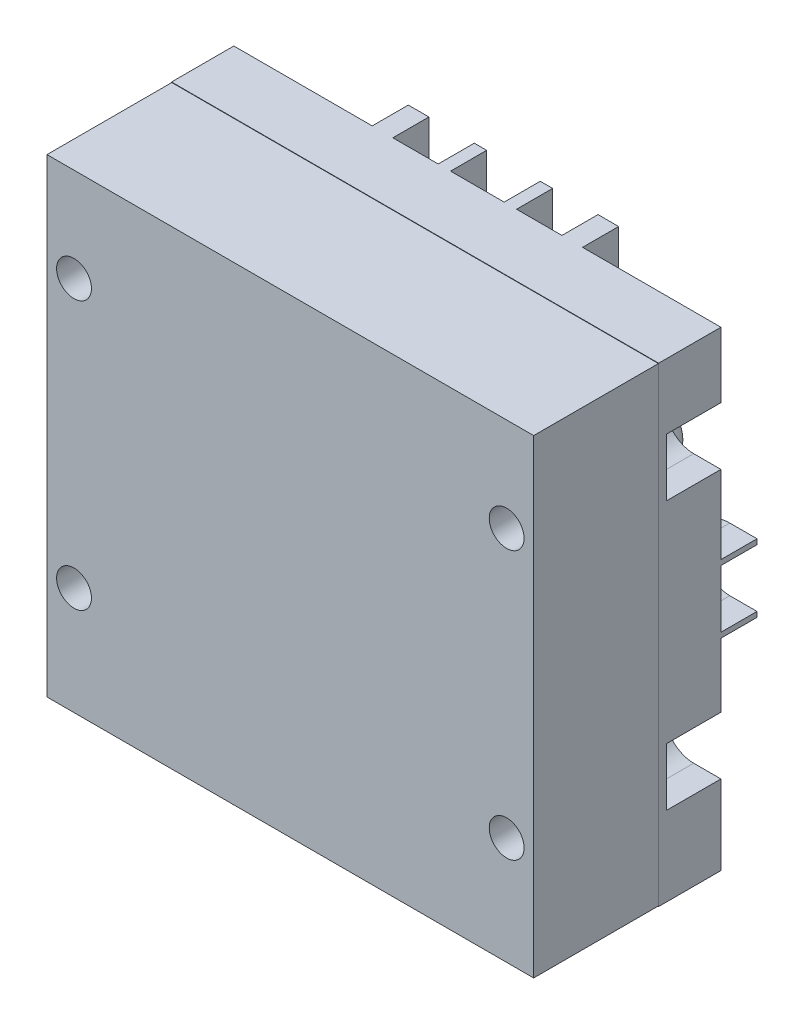
from build123d import *

# Parameters (mm, degrees)
SKETCH1_W           = 59.9948
SKETCH1_H           = 57.9628
BOSS_EXTRUDE1_DEPTH = 27.4828
SKETCH2_R           = 2.1463
CUT_EXTRUDE1_DEPTH  = 50.950674155
CUT_EXTRUDE2_DEPTH  = 11.176
SKETCH4_W           = 5.588
SKETCH4_H           = 28.2194
CUT_EXTRUDE3_DEPTH  = 4.445
SKETCH5_W           = 59.9948
SKETCH5_H           = 57.9628
SKETCH5_W_2         = 59.944
SKETCH5_H_2         = 57.8612
CUT_EXTRUDE4_DEPTH  = 15.367
SKETCH6_R           = 3.81
BOSS_EXTRUDE2_DEPTH = 5.207
FILLET1_R           = 2.54


with BuildPart() as part:
    # Sketch1 → Boss-Extrude1 (new body)
    with BuildSketch(Plane.XY):
        Rectangle(SKETCH1_W, SKETCH1_H)
    extrude(amount=BOSS_EXTRUDE1_DEPTH)

    # Sketch2 → Cut-Extrude1 (cut, through all)
    with BuildSketch(Plane.XY.offset(27.4828)):
        with Locations((-26.6446, -15.6464)):
            Circle(SKETCH2_R)
        with Locations((-26.6446, 17.3736)):
            Circle(SKETCH2_R)
    cut_extrude1 = extrude(amount=-CUT_EXTRUDE1_DEPTH, mode=Mode.SUBTRACT)

    # Mirror1: Cut-Extrude1 across plane
    add(cut_extrude1.mirror(Plane(origin=(0, 0, 0), x_dir=(0, 0, 1), z_dir=(1, 0, 0))), mode=Mode.SUBTRACT)

    # Sketch3 → Cut-Extrude2 (cut)
    with BuildSketch(Plane(origin=(0, 0, 0), x_dir=(-1, 0, 0), z_dir=(0, 0, -1))):
        with BuildLine():
            Line((-26.6446, 20.9296), (-29.9974, 20.9296))
            Line((-29.9974, 20.9296), (-29.9974, 13.8176))
            Line((-29.9974, 13.8176), (-26.6446, 13.8176))
            ThreePointArc((-26.6446, 13.8176), (-23.0886, 17.3736), (-26.6446, 20.9296))
        make_face()
        with BuildLine():
            Line((-26.6446, -12.0904), (-29.9974, -12.0904))
            Line((-29.9974, -12.0904), (-29.9974, -19.2024))
            Line((-29.9974, -19.2024), (-26.6446, -19.2024))
            ThreePointArc((-26.6446, -19.2024), (-23.0886, -15.6464), (-26.6446, -12.0904))
        make_face()
        with BuildLine():
            Line((26.6446, 20.9296), (29.9974, 20.9296))
            Line((29.9974, 20.9296), (29.9974, 13.8176))
            Line((29.9974, 13.8176), (26.6446, 13.8176))
            ThreePointArc((26.6446, 13.8176), (23.0886, 17.3736), (26.6446, 20.9296))
        make_face()
        with BuildLine():
            Line((26.6446, -12.0904), (29.9974, -12.0904))
            Line((29.9974, -12.0904), (29.9974, -19.2024))
            Line((29.9974, -19.2024), (26.6446, -19.2024))
            ThreePointArc((26.6446, -19.2024), (23.0886, -15.6464), (26.6446, -12.0904))
        make_face()
    extrude(amount=-CUT_EXTRUDE2_DEPTH, mode=Mode.SUBTRACT)

    # Sketch4 → Cut-Extrude3 (cut)
    with BuildSketch(Plane(origin=(0, 0, 0), x_dir=(-1, 0, 0), z_dir=(0, 0, -1))):
        with BuildLine():
            ThreePointArc((22.518386513, 0.762), (23.960485441, 3.225183836), (26.6446, 4.195984001))
            Line((26.6446, 4.195984001), (29.9974, 4.195984001))
            Line((29.9974, 4.195984001), (29.9974, 28.9814))
            Line((29.9974, 28.9814), (12.954, 28.9814))
            Line((12.954, 28.9814), (12.954, 0.762))
            Line((12.954, 0.762), (22.518386513, 0.762))
        make_face()
        with BuildLine():
            Line((29.9974, -28.9814), (29.9974, -4.195984001))
            Line((29.9974, -4.195984001), (26.6446, -4.195984001))
            ThreePointArc((26.6446, -4.195984001), (23.960485441, -3.225183836), (22.518386513, -0.762))
            Line((22.518386513, -0.762), (12.954, -0.762))
            Line((12.954, -0.762), (12.954, -28.9814))
            Line((12.954, -28.9814), (29.9974, -28.9814))
        make_face()
        with BuildLine():
            Line((29.9974, -3.556), (29.9974, 3.556))
            Line((29.9974, 3.556), (26.6446, 3.556))
            ThreePointArc((26.6446, 3.556), (23.0886, 0), (26.6446, -3.556))
            Line((26.6446, -3.556), (29.9974, -3.556))
        make_face()
        Polygon((0, -28.9814), (10.414, -28.9814), (10.414, -0.762), (3.302, -0.762), (3.302, 28.9814), (0, 28.9814), align=None)
        with Locations((7.62, 14.8717)):
            Rectangle(SKETCH4_W, SKETCH4_H)
    cut_extrude3 = extrude(amount=-CUT_EXTRUDE3_DEPTH, mode=Mode.SUBTRACT)

    # Mirror2: Cut-Extrude3 across plane
    add(cut_extrude3.mirror(Plane(origin=(0, 0, 0), x_dir=(0, 0, 1), z_dir=(1, 0, 0))), mode=Mode.SUBTRACT)

    # Sketch5 → Cut-Extrude4 (cut)
    with BuildSketch(Plane.XY.offset(27.4828)):
        Rectangle(SKETCH5_W, SKETCH5_H)
        Rectangle(SKETCH5_W_2, SKETCH5_H_2, mode=Mode.SUBTRACT)
    extrude(amount=-CUT_EXTRUDE4_DEPTH, mode=Mode.SUBTRACT)

    # Sketch6 → Boss-Extrude2 (add)
    with BuildSketch(Plane(origin=(0, 0, 4.445), x_dir=(-1, 0, 0), z_dir=(0, 0, -1))):
        with Locations((-17.78, 10.16)):
            Circle(SKETCH6_R)
        with Locations((17.78, 10.16)):
            Circle(SKETCH6_R)
        with Locations((17.78, -10.16)):
            Circle(SKETCH6_R)
        with Locations((-17.78, -10.16)):
            Circle(SKETCH6_R)
    extrude(amount=BOSS_EXTRUDE2_DEPTH)

    # Fillet1
    fillet1_edges = [part.edges().sort_by_distance(p)[0] for p in [
        (21.59, 10.16, -0.762),
        (-13.97, 10.16, -0.762),
        (-13.97, -10.16, -0.762),
        (21.59, -10.16, -0.762),
    ]]
    fillet(fillet1_edges, radius=FILLET1_R)


solid = part.part
